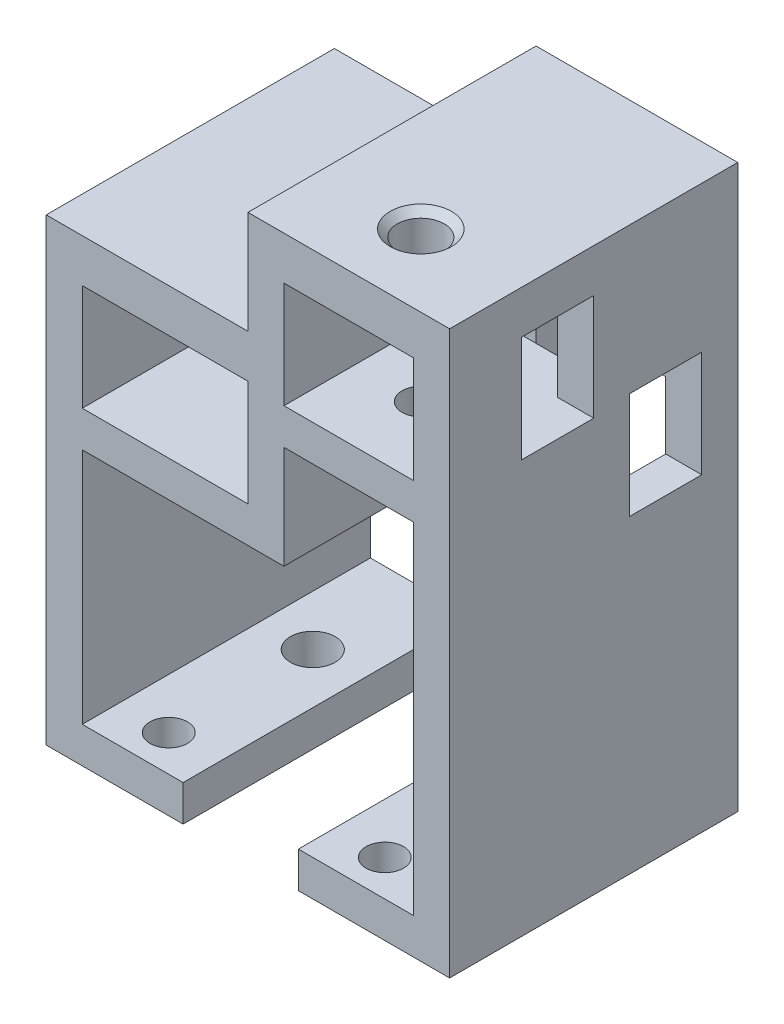
from build123d import *

# Parameters (mm, degrees)
SKETCH1_W           = 18
SKETCH1_H           = 14.75
SKETCH1_W_2         = 23
BOSS_EXTRUDE1_DEPTH = 40
CUT_EXTRUDE1_REACH  = 106.057
SKETCH2_R           = 2.6
CUT_EXTRUDE2_REACH  = 106.057
SKETCH3_W           = 10
SKETCH3_H           = 14.75
SKETCH4_W           = 10
SKETCH4_H           = 14.75
CUT_EXTRUDE3_DEPTH  = 102.453449917
CUT_EXTRUDE4_REACH  = 106.057
SKETCH6_R           = 3.25
CHAMFER1_SIZE       = 1
CUT_EXTRUDE5_REACH  = 106.057
SKETCH7_R           = 2.6
SKETCH7_R_2         = 3.1


with BuildPart() as part:
    # Sketch1 → Boss-Extrude1 (new body)
    with BuildSketch(Plane.XY):
        Polygon((0, 0), (0, 63.75), (28, 63.75), (28, 78.05), (56, 78.05), (56, 0), (35, 0), (35, 5), (51, 5), (51, 52.3), (33, 52.3), (33, 38), (5, 38), (5, 5), (19, 5), (19, 0), align=None)
        with Locations((42, 64.675)):
            Rectangle(SKETCH1_W, SKETCH1_H, mode=Mode.SUBTRACT)
        with Locations((16.5, 50.375)):
            Rectangle(SKETCH1_W_2, SKETCH1_H, mode=Mode.SUBTRACT)
    extrude(amount=BOSS_EXTRUDE1_DEPTH)

    # Cut-Extrude1: up to this face of the body (flat: up to its plane)
    cut_extrude1_end = Plane(part.part.faces().sort_by_distance((19, 38, 20))[0])
    # Sketch2 → Cut-Extrude1 (cut, up to the picked face)
    with BuildSketch(Plane(origin=(0, 78.05, 0), x_dir=(1, 0, 0), z_dir=(0, 1, 0)), mode=Mode.PRIVATE) as cut_extrude1_sk1:
        with Locations(Location((19, -15, 0), (0, 0, 270))):
            Circle(SKETCH2_R)
    cut_extrude1_tool1 = split(extrude(cut_extrude1_sk1.sketch, amount=-CUT_EXTRUDE1_REACH, mode=Mode.PRIVATE), bisect_by=cut_extrude1_end, keep=Keep.BOTH, mode=Mode.PRIVATE)
    # Sketch2 → Cut-Extrude1 (cut, up to the picked face)
    with BuildSketch(Plane(origin=(0, 78.05, 0), x_dir=(1, 0, 0), z_dir=(0, 1, 0)), mode=Mode.PRIVATE) as cut_extrude1_sk2:
        with Locations(Location((42, -30, 0), (0, 0, 270))):
            Circle(SKETCH2_R)
    cut_extrude1_tool2 = split(extrude(cut_extrude1_sk2.sketch, amount=-CUT_EXTRUDE1_REACH, mode=Mode.PRIVATE), bisect_by=cut_extrude1_end, keep=Keep.BOTH, mode=Mode.PRIVATE)
    add(cut_extrude1_tool1.solids().sort_by(Axis((19, 78.05, 15), (0, -1, 0)))[0], mode=Mode.SUBTRACT)
    add(cut_extrude1_tool2.solids().sort_by(Axis((42, 78.05, 30), (0, -1, 0)))[0], mode=Mode.SUBTRACT)

    # Sketch3 → Cut-Extrude2 (cut, up to next)
    with BuildSketch(Plane(origin=(56, 0, 0), x_dir=(0, 0, -1), z_dir=(1, 0, 0)), mode=Mode.PRIVATE) as cut_extrude2_sk1:
        with Locations((-25, 64.675)):
            Rectangle(SKETCH3_W, SKETCH3_H)
    cut_extrude2_tool1 = extrude(cut_extrude2_sk1.sketch, amount=-CUT_EXTRUDE2_REACH, mode=Mode.PRIVATE) & part.part
    add(cut_extrude2_tool1.solids().sort_by_distance((56, 64.675, 25))[0], mode=Mode.SUBTRACT)

    # Sketch4 → Cut-Extrude3 (cut, through all)
    with BuildSketch(Plane(origin=(5, 0, 0), x_dir=(0, 0, -1), z_dir=(1, 0, 0))):
        with Locations((-10, 50.375)):
            Rectangle(SKETCH4_W, SKETCH4_H)
    extrude(amount=CUT_EXTRUDE3_DEPTH, mode=Mode.SUBTRACT)

    # Sketch6 → Cut-Extrude4 (cut, up to next)
    with BuildSketch(Plane(origin=(0, 78.05, 0), x_dir=(1, 0, 0), z_dir=(0, 1, 0)), mode=Mode.PRIVATE) as cut_extrude4_sk1:
        with Locations(Location((19, -15, 0), (0, 0, 270))):
            Circle(SKETCH6_R)
    cut_extrude4_tool1 = extrude(cut_extrude4_sk1.sketch, amount=-CUT_EXTRUDE4_REACH, mode=Mode.PRIVATE) & part.part
    # Sketch6 → Cut-Extrude4 (cut, up to next)
    with BuildSketch(Plane(origin=(0, 78.05, 0), x_dir=(1, 0, 0), z_dir=(0, 1, 0)), mode=Mode.PRIVATE) as cut_extrude4_sk2:
        with Locations(Location((42, -30, 0), (0, 0, 270))):
            Circle(SKETCH6_R)
    cut_extrude4_tool2 = extrude(cut_extrude4_sk2.sketch, amount=-CUT_EXTRUDE4_REACH, mode=Mode.PRIVATE) & part.part
    add(cut_extrude4_tool1.solids().sort_by_distance((19, 78.05, 15))[0], mode=Mode.SUBTRACT)
    add(cut_extrude4_tool2.solids().sort_by_distance((42, 78.05, 30))[0], mode=Mode.SUBTRACT)

    # Chamfer1
    chamfer1_edges = [part.edges().sort_by_distance(p)[0] for p in [
        (19, 63.75, 11.75),
        (42, 78.05, 26.75),
    ]]
    chamfer(chamfer1_edges, length=CHAMFER1_SIZE)

    # Sketch7 → Cut-Extrude5 (cut, up to next)
    with BuildSketch(Plane.XZ, mode=Mode.PRIVATE) as cut_extrude5_sk1:
        with Locations((12, 35)):
            Circle(SKETCH7_R)
    cut_extrude5_tool1 = extrude(cut_extrude5_sk1.sketch, amount=-CUT_EXTRUDE5_REACH, mode=Mode.PRIVATE) & part.part
    # Sketch7 → Cut-Extrude5 (cut, up to next)
    with BuildSketch(Plane.XZ, mode=Mode.PRIVATE) as cut_extrude5_sk2:
        with Locations((42, 35)):
            Circle(SKETCH7_R)
    cut_extrude5_tool2 = extrude(cut_extrude5_sk2.sketch, amount=-CUT_EXTRUDE5_REACH, mode=Mode.PRIVATE) & part.part
    # Sketch7 → Cut-Extrude5 (cut, up to next)
    with BuildSketch(Plane.XZ, mode=Mode.PRIVATE) as cut_extrude5_sk3:
        with Locations((12, 15)):
            Circle(SKETCH7_R_2)
    cut_extrude5_tool3 = extrude(cut_extrude5_sk3.sketch, amount=-CUT_EXTRUDE5_REACH, mode=Mode.PRIVATE) & part.part
    # Sketch7 → Cut-Extrude5 (cut, up to next)
    with BuildSketch(Plane.XZ, mode=Mode.PRIVATE) as cut_extrude5_sk4:
        with Locations((42, 15)):
            Circle(SKETCH7_R_2)
    cut_extrude5_tool4 = extrude(cut_extrude5_sk4.sketch, amount=-CUT_EXTRUDE5_REACH, mode=Mode.PRIVATE) & part.part
    add(cut_extrude5_tool1.solids().sort_by_distance((12, 0, 35))[0], mode=Mode.SUBTRACT)
    add(cut_extrude5_tool2.solids().sort_by_distance((42, 0, 35))[0], mode=Mode.SUBTRACT)
    add(cut_extrude5_tool3.solids().sort_by_distance((12, 0, 15))[0], mode=Mode.SUBTRACT)
    add(cut_extrude5_tool4.solids().sort_by_distance((42, 0, 15))[0], mode=Mode.SUBTRACT)


solid = part.part
